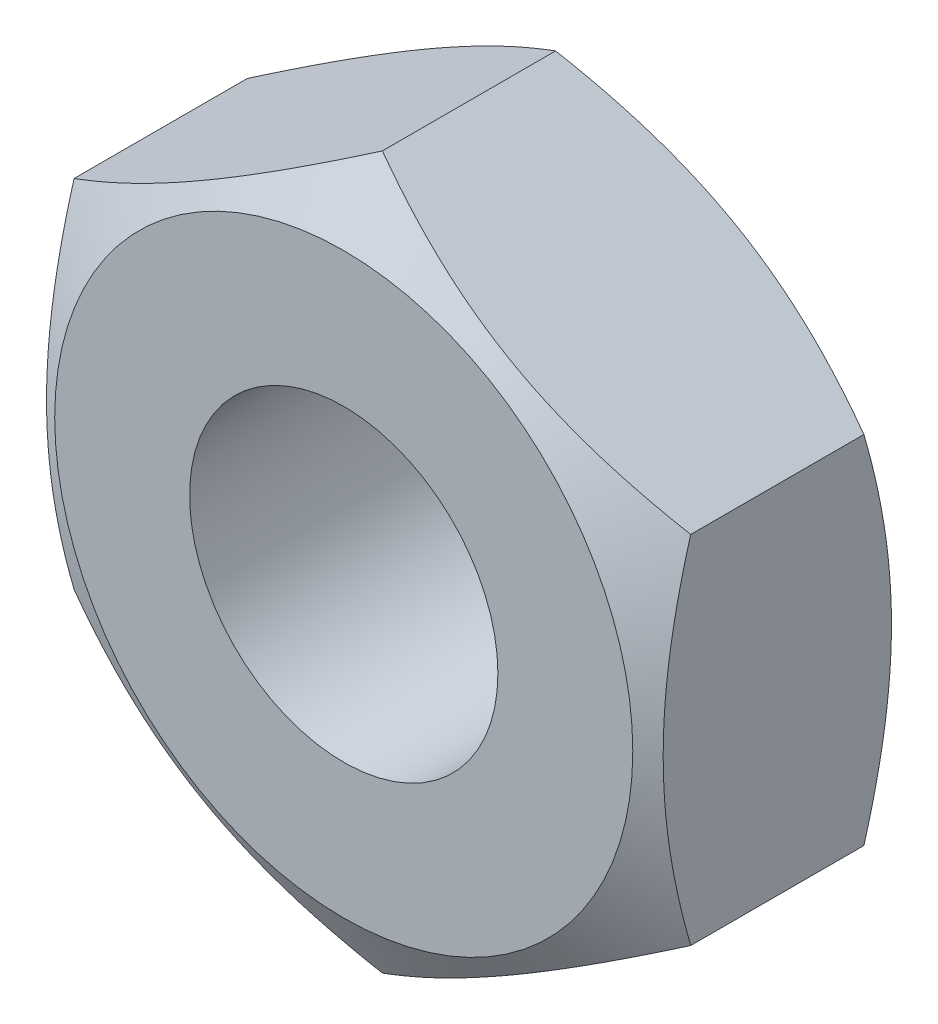
from build123d import *

# Parameters (mm, degrees)
SKETCH1_R      = 0.8
EXTRUDE1_DEPTH = 1.3


with BuildPart() as part:
    # Sketch1 → Extrude1 (new body)
    with BuildSketch(Plane.XY):
        Polygon((0, 1.847520861), (-1.6, 0.923760431), (-1.6, -0.923760431), (0, -1.847520861), (1.6, -0.923760431), (1.6, 0.923760431), align=None)
        Circle(SKETCH1_R, mode=Mode.SUBTRACT)
    extrude(amount=EXTRUDE1_DEPTH)

    # Sketch2 → Cut-Revolve1 (revolve, cut)
    with BuildSketch(Plane(origin=(0, 0, 0), x_dir=(1, 0, 0), z_dir=(0, 1, 0)), mode=Mode.PRIVATE) as cut_revolve1_sk:
        Polygon((-3.192737518, -1.3), (-1.5, -1.3), (-2.625833025, -0.65), (-1.5, 0), (-3.192737518, 0), align=None)
    revolve(cut_revolve1_sk.sketch.rotate(Axis((0, 0, 0), (0, 0, -1)), 180), axis=Axis((0, 0, 0), (0, 0, -1)), mode=Mode.SUBTRACT)


solid = part.part
